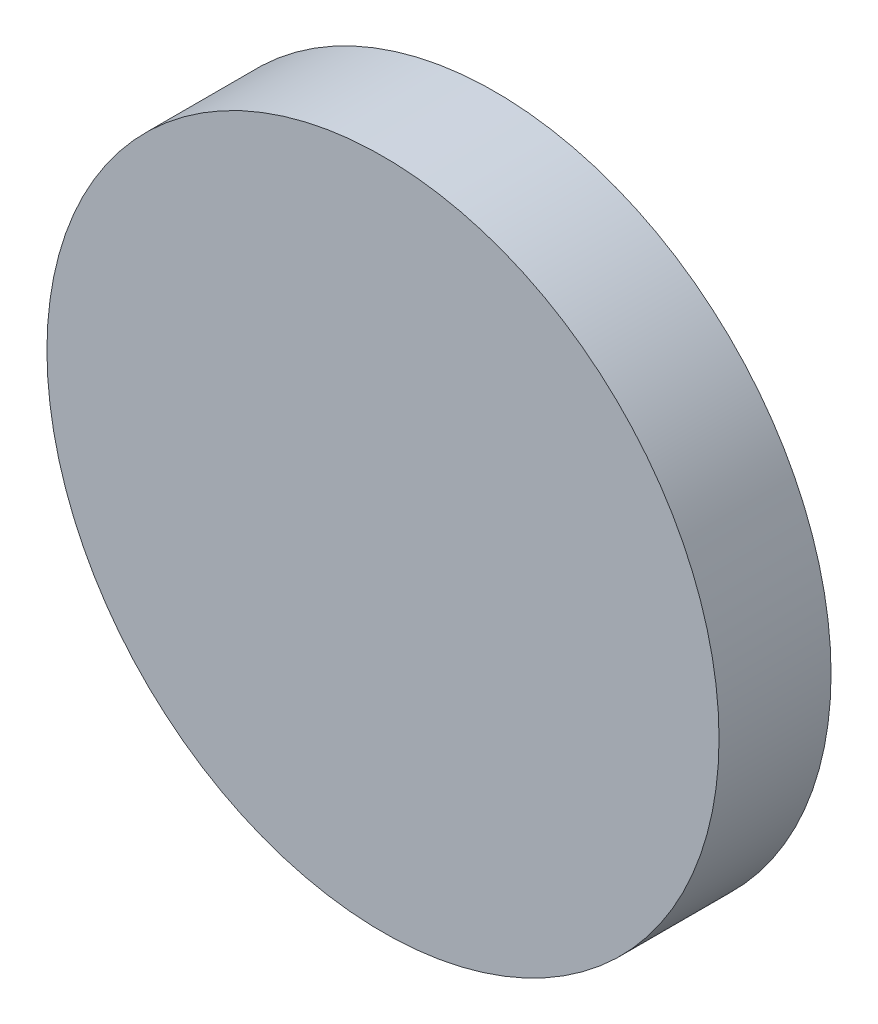
from build123d import *

# Parameters (mm, degrees)
SKETCH_1_R      = 21
EXTRUDE_1_DEPTH = 7


with BuildPart() as part:
    # 草图1 → 凸台-拉伸1 (new body)
    with BuildSketch(Plane.XY):
        Circle(SKETCH_1_R)
    extrude(amount=EXTRUDE_1_DEPTH)


solid = part.part
